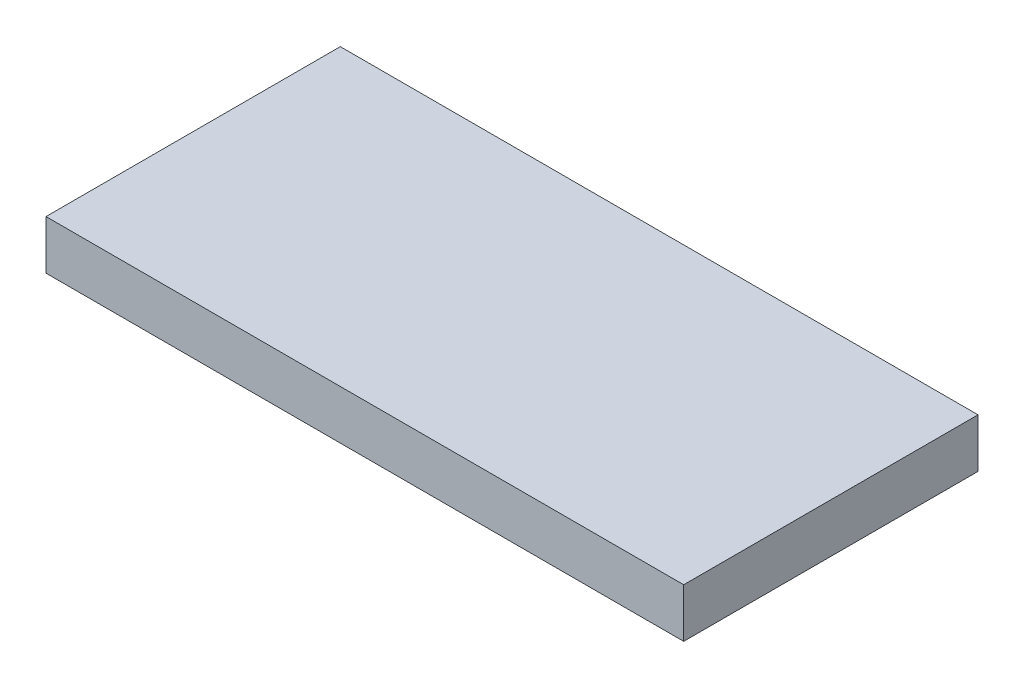
from build123d import *

# Parameters (mm, degrees)
SKETCH1_W           = 65
SKETCH1_H           = 30
BOSS_EXTRUDE1_DEPTH = 5


with BuildPart() as part:
    # Sketch1 → Boss-Extrude1 (new body)
    with BuildSketch(Plane(origin=(0, 0, 0), x_dir=(1, 0, 0), z_dir=(0, 1, 0))):
        with Locations((-32.5, -15)):
            Rectangle(SKETCH1_W, SKETCH1_H)
    extrude(amount=BOSS_EXTRUDE1_DEPTH)


solid = part.part
